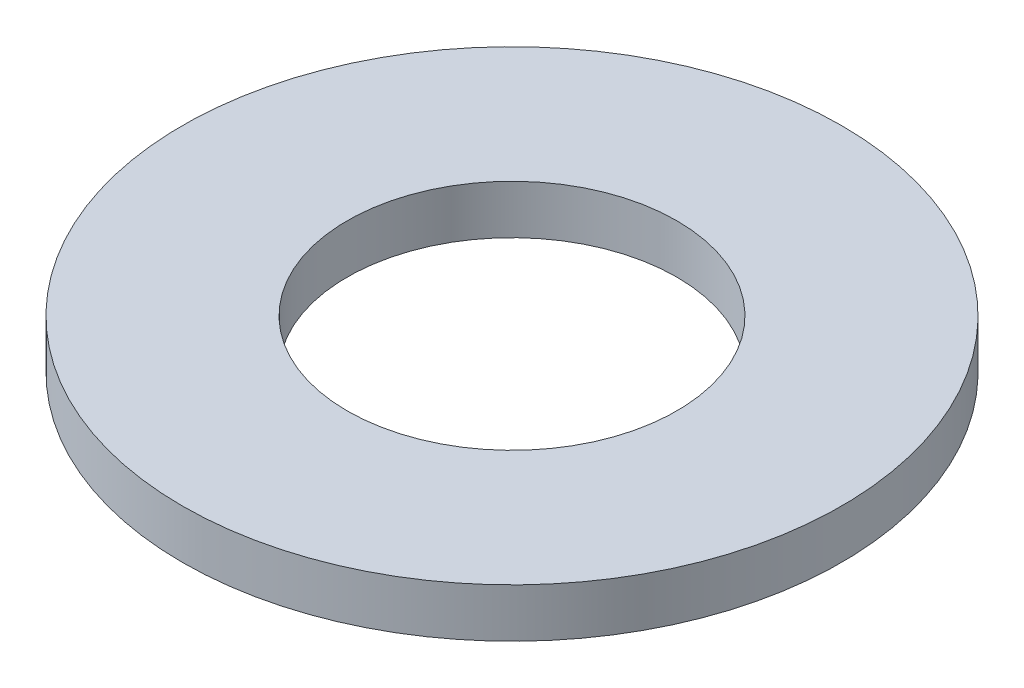
from build123d import *

# Parameters (mm, degrees)
BOSS_EXTRUDE1_DEPTH      = 0.6477
BOSS_EXTRUDE1_DEPTH_BACK = 0.6477
SKETCH3_R                = 8.7376
SKETCH3_R_2              = 4.3688


with BuildPart() as part:
    # Sketch3 → Boss-Extrude1 (new, two sides: drawn at the far end of the back side and taken through both)
    with BuildSketch(Plane(origin=(0, 0, 0), x_dir=(1, 0, 0), z_dir=(0, 1, 0)).offset(-BOSS_EXTRUDE1_DEPTH_BACK)):
        with Locations(Location((0, 0, 0), (0, 0, 270))):
            Circle(SKETCH3_R)
        with Locations(Location((0, 0, 0), (0, 0, 270))):
            Circle(SKETCH3_R_2, mode=Mode.SUBTRACT)
    extrude(amount=BOSS_EXTRUDE1_DEPTH + BOSS_EXTRUDE1_DEPTH_BACK)


solid = part.part
